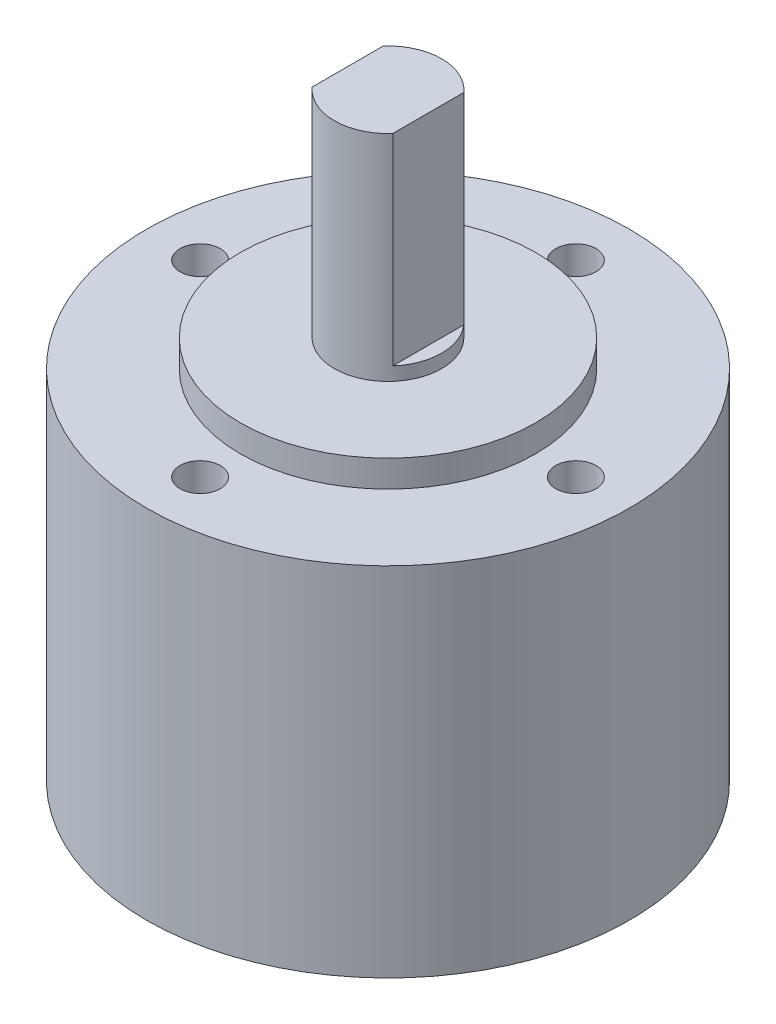
from build123d import *

# Parameters (mm, degrees)
SKETCH1_R           = 18
BOSS_EXTRUDE1_DEPTH = 13.3
SKETCH2_R           = 11
BOSS_EXTRUDE2_DEPTH = 2
SKETCH4_R           = 1.5
CUT_EXTRUDE1_DEPTH  = 39.287857083
SKETCH5_R           = 4
BOSS_EXTRUDE3_DEPTH = 16
CUT_EXTRUDE2_DEPTH  = 15


with BuildPart() as part:
    # Sketch1 → Boss-Extrude1 (new, symmetric)
    with BuildSketch(Plane(origin=(0, 0, 0), x_dir=(1, 0, 0), z_dir=(0, 1, 0))):
        with Locations(Location((0, 0, 0), (0, 0, 270))):
            Circle(SKETCH1_R)
    extrude(amount=BOSS_EXTRUDE1_DEPTH, both=True)

    # Sketch2 → Boss-Extrude2 (add)
    with BuildSketch(Plane(origin=(0, 13.3, 0), x_dir=(1, 0, 0), z_dir=(0, 1, 0))):
        with Locations(Location((0, 0, 0), (0, 0, 270))):
            Circle(SKETCH2_R)
    extrude(amount=BOSS_EXTRUDE2_DEPTH)

    # Sketch4 → Cut-Extrude1 (cut, through all)
    with BuildSketch(Plane(origin=(0, 15.3, 0), x_dir=(1, 0, 0), z_dir=(0, 1, 0))):
        with Locations(Location((-14, 0, 0), (0, 0, 270))):
            Circle(SKETCH4_R)
        with Locations(Location((0, -14, 0), (0, 0, 270))):
            Circle(SKETCH4_R)
        with Locations(Location((14, 0, 0), (0, 0, 270))):
            Circle(SKETCH4_R)
        with Locations(Location((0, 14, 0), (0, 0, 270))):
            Circle(SKETCH4_R)
    extrude(amount=-CUT_EXTRUDE1_DEPTH, mode=Mode.SUBTRACT)

    # Sketch5 → Boss-Extrude3 (add)
    with BuildSketch(Plane(origin=(0, 15.3, 0), x_dir=(1, 0, 0), z_dir=(0, 1, 0))):
        with Locations(Location((0, 0, 0), (0, 0, 270))):
            Circle(SKETCH5_R)
    extrude(amount=BOSS_EXTRUDE3_DEPTH)

    # Sketch6 → Cut-Extrude2 (cut)
    with BuildSketch(Plane(origin=(0, 31.3, 0), x_dir=(1, 0, 0), z_dir=(0, 1, 0))):
        with BuildLine():
            Line((-3, -4), (-3, 4))
            ThreePointArc((-3, 4), (-5, 0), (-3, -4))
        make_face()
        with BuildLine():
            Line((3, -4), (3, 4))
            ThreePointArc((3, 4), (5, 0), (3, -4))
        make_face()
    extrude(amount=-CUT_EXTRUDE2_DEPTH, mode=Mode.SUBTRACT)


solid = part.part
